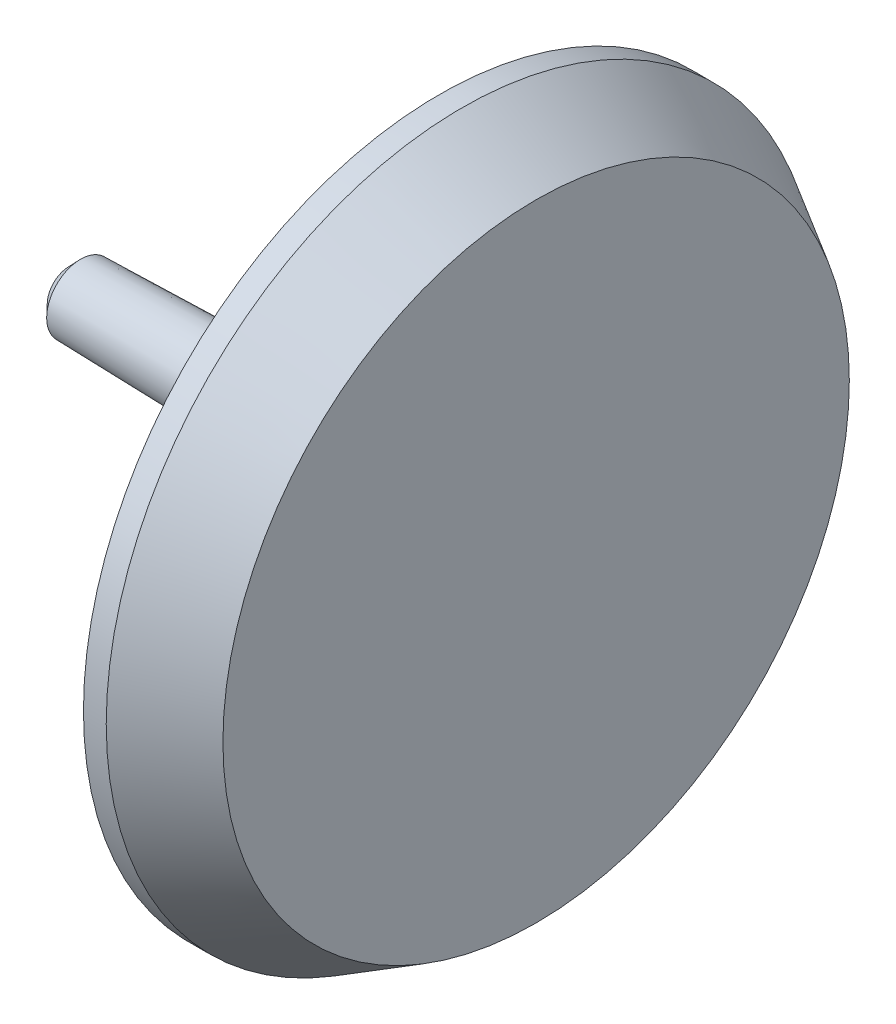
from build123d import *

# Parameters (mm, degrees)
FILLET1_R      = 2.54
CHAMFER1_SIZE  = 2.54
CHAMFER1_SIZE2 = 2.60331341


with BuildPart() as part:
    # Sketch1 → Revolve1 (revolve)
    with BuildSketch(Plane.XY, mode=Mode.PRIVATE) as revolve1_sk:
        Polygon((0, 0), (0, 7.493), (66.04, 9.0805), (71.12, 9.0805), (82.562216058, 79.375), (87.642216058, 79.375), (104.14, 69.85), (104.14, 0), align=None)
    revolve(revolve1_sk.sketch.rotate(Axis((-13.738402674, 0, 0), (1, 0, 0)), 90), axis=Axis((-13.738402674, 0, 0), (1, 0, 0)))

    # Fillet1
    fillet1_edges = [part.edges().sort_by_distance(p)[0] for p in [
        (71.12, 0, -9.0805),
    ]]
    fillet(fillet1_edges, radius=FILLET1_R)

    # Chamfer1
    chamfer1_edges = [part.edges().sort_by_distance(p)[0] for p in [
        (0, 0, -7.493),
    ]]
    chamfer1_side = [part.faces().sort_by_distance(p)[0] for p in [
        (33.02, 0, -8.28675),
    ]]
    chamfer(chamfer1_edges, length=CHAMFER1_SIZE, length2=CHAMFER1_SIZE2, reference=chamfer1_side[0])


solid = part.part
